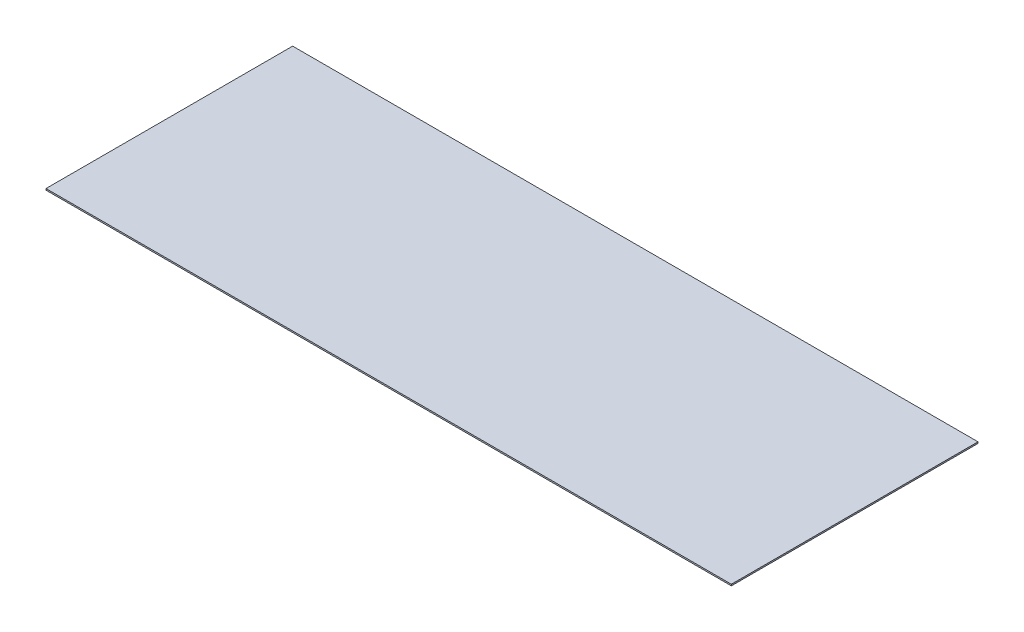
from build123d import *

# Parameters (mm, degrees)
F_304_FLOOR_1400X500_T3_START = -3
SKETCH_1_W                    = 1406
SKETCH_1_H                    = 3
F_304_FLOOR_1400X500_T3_DEPTH = 506


with BuildPart() as part:
    # 草图1 → 304_floor_1400x500_t3 (new body)
    with BuildSketch(Plane.XY.offset(F_304_FLOOR_1400X500_T3_START)):
        with Locations((700, -1.5)):
            Rectangle(SKETCH_1_W, SKETCH_1_H)
    extrude(amount=F_304_FLOOR_1400X500_T3_DEPTH)


solid = part.part
